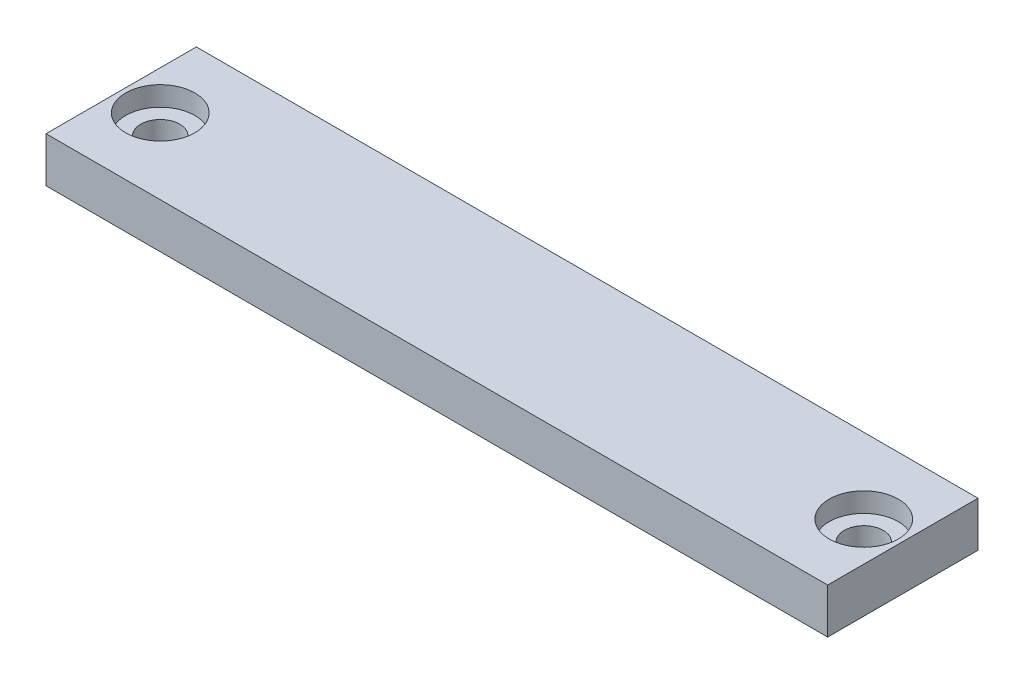
from build123d import *

# Parameters (mm, degrees)
BOSS_EXTRUDE1_START = -40
SKETCH1_W           = 52
SKETCH1_H           = 3
BOSS_EXTRUDE1_DEPTH = 10
BOSS_EXTRUDE2_START = 20
SKETCH2_R           = 1.3
BOSS_EXTRUDE2_DEPTH = 6
BOSS_EXTRUDE3_START = 23.45
SKETCH3_R           = 2.3
BOSS_EXTRUDE3_DEPTH = 2.55
BOSS_EXTRUDE4_START = 20
SKETCH4_R           = 1.3
BOSS_EXTRUDE4_DEPTH = 6
BOSS_EXTRUDE5_START = 23.45
SKETCH5_R           = 2.3
BOSS_EXTRUDE5_DEPTH = 2.55


with BuildPart() as part:
    # Sketch1 → Boss-Extrude1 (new body)
    with BuildSketch(Plane.XY.offset(BOSS_EXTRUDE1_START)):
        with Locations((0, 23.25)):
            Rectangle(SKETCH1_W, SKETCH1_H)
    extrude(amount=BOSS_EXTRUDE1_DEPTH)


with BuildPart() as body_2:
    # Sketch2 → Boss-Extrude2 (new body)
    with BuildSketch(Plane(origin=(0, 0, 0), x_dir=(1, 0, 0), z_dir=(0, 1, 0)).offset(BOSS_EXTRUDE2_START)):
        with Locations(Location((-23.4, 35, 0), (0, 0, 270))):
            Circle(SKETCH2_R)
    extrude(amount=BOSS_EXTRUDE2_DEPTH)


with BuildPart() as part_1:
    add(part.part)

    # Combine1: cut body 2
    add(body_2.part, mode=Mode.SUBTRACT)


with BuildPart() as body_2_2:
    # Sketch3 → Boss-Extrude3 (new body)
    with BuildSketch(Plane(origin=(0, 0, 0), x_dir=(1, 0, 0), z_dir=(0, 1, 0)).offset(BOSS_EXTRUDE3_START)):
        with Locations(Location((-23.4, 35, 0), (0, 0, 270))):
            Circle(SKETCH3_R)
    extrude(amount=BOSS_EXTRUDE3_DEPTH)


with BuildPart() as part_2:
    add(part_1.part)

    # Combine2: cut body 2 2
    add(body_2_2.part, mode=Mode.SUBTRACT)


with BuildPart() as body_2_3:
    # Sketch4 → Boss-Extrude4 (new body)
    with BuildSketch(Plane(origin=(0, 0, 0), x_dir=(1, 0, 0), z_dir=(0, 1, 0)).offset(BOSS_EXTRUDE4_START)):
        with Locations(Location((23.4, 35, 0), (0, 0, 270))):
            Circle(SKETCH4_R)
    extrude(amount=BOSS_EXTRUDE4_DEPTH)


with BuildPart() as part_3:
    add(part_2.part)

    # Combine3: cut body 2 3
    add(body_2_3.part, mode=Mode.SUBTRACT)


with BuildPart() as body_2_4:
    # Sketch5 → Boss-Extrude5 (new body)
    with BuildSketch(Plane(origin=(0, 0, 0), x_dir=(1, 0, 0), z_dir=(0, 1, 0)).offset(BOSS_EXTRUDE5_START)):
        with Locations(Location((23.4, 35, 0), (0, 0, 270))):
            Circle(SKETCH5_R)
    extrude(amount=BOSS_EXTRUDE5_DEPTH)


with BuildPart() as part_4:
    add(part_3.part)

    # Combine4: cut body 2 4
    add(body_2_4.part, mode=Mode.SUBTRACT)


solid = part_4.part
